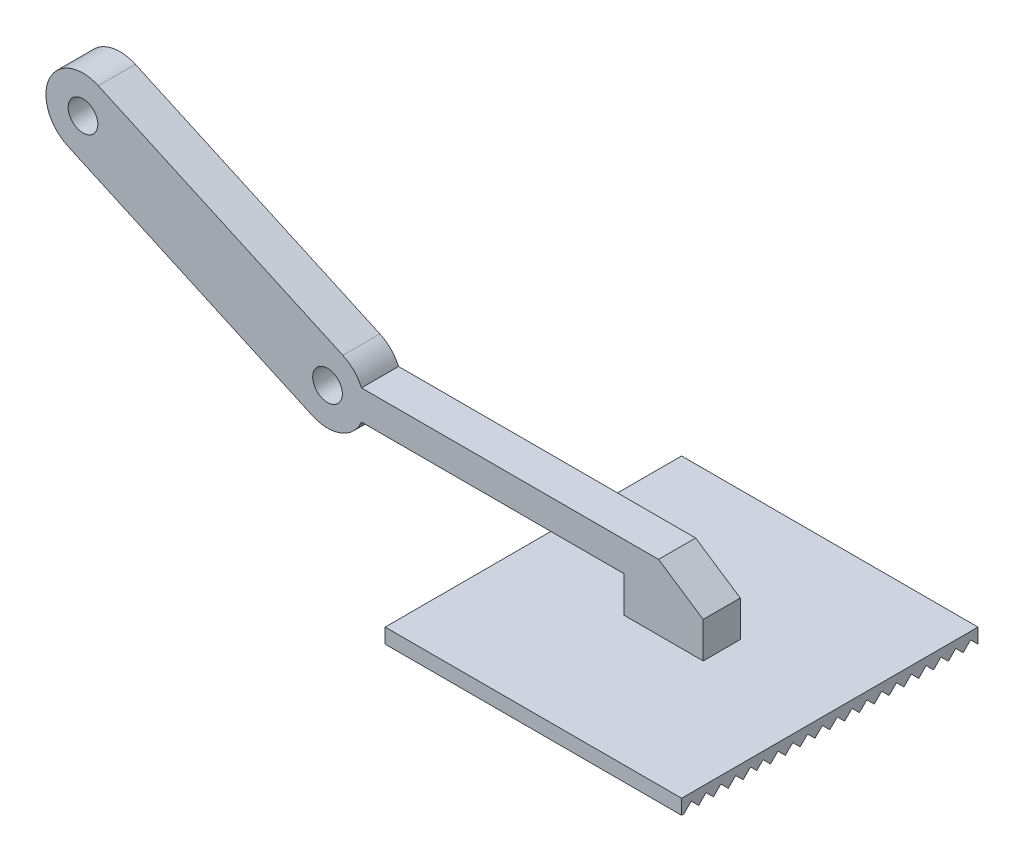
from build123d import *

# Parameters (mm, degrees)
SKETCH_1_R          = 2
EXTRUDE_1_DEPTH     = 2.5
SKETCH_2_W          = 40
SKETCH_2_H          = 40
EXTRUDE_2_DEPTH     = 2
CUT_EXTRUDE_1_DEPTH = 40


with BuildPart() as part:
    # 草图1 → 凸台-拉伸1 (new, symmetric)
    with BuildSketch(Plane.XY):
        with BuildLine():
            Line((2.069014722, 4.551832387), (35.069014722, -10.448167613))
            ThreePointArc((35.069014722, -10.448167613), (36.562144846, -11.491278851), (37.582575695, -13))
            Line((37.582575695, -13), (73, -13))
            Line((73, -13), (77.669363216, -13))
            Line((77.669363216, -13), (83.69352751, -17))
            Line((83.69352751, -17), (83.69352751, -21.856832822))
            Line((83.69352751, -21.856832822), (73, -21.856832822))
            Line((73, -21.856832822), (73, -17))
            Line((73, -17), (37.582575695, -17))
            ThreePointArc((37.582575695, -17), (34.790938113, -19.668248138), (30.930985278, -19.551832387))
            Line((30.930985278, -19.551832387), (-2.069014722, -4.551832387))
            ThreePointArc((-2.069014722, -4.551832387), (-4.551832387, 2.069014722), (2.069014722, 4.551832387))
        make_face()
        Circle(SKETCH_1_R, mode=Mode.SUBTRACT)
        with Locations((33, -15)):
            Circle(SKETCH_1_R, mode=Mode.SUBTRACT)
    extrude(amount=EXTRUDE_1_DEPTH, both=True)

    # 草图2 → 凸台-拉伸2 (add)
    with BuildSketch(Plane.XZ.offset(21.856832822)):
        with Locations((78.275712014, 0)):
            Rectangle(SKETCH_2_W, SKETCH_2_H)
    extrude(amount=EXTRUDE_2_DEPTH)

    # 草图4 → 切除-拉伸1 (cut)
    with BuildSketch(Plane.ZY.offset(-58.275712014)):
        Polygon((-19, -22.856832822), (-20, -23.856832822), (-18, -23.856832822), align=None)
        Polygon((-17, -22.856832822), (-18, -23.856832822), (-16, -23.856832822), align=None)
        Polygon((-15, -22.856832822), (-16, -23.856832822), (-14, -23.856832822), align=None)
        Polygon((-13, -22.856832822), (-14, -23.856832822), (-12, -23.856832822), align=None)
        Polygon((-11, -22.856832822), (-12, -23.856832822), (-10, -23.856832822), align=None)
        Polygon((-9, -22.856832822), (-10, -23.856832822), (-8, -23.856832822), align=None)
        Polygon((-7, -22.856832822), (-8, -23.856832822), (-6, -23.856832822), align=None)
        Polygon((-5, -22.856832822), (-6, -23.856832822), (-4, -23.856832822), align=None)
        Polygon((-3, -22.856832822), (-4, -23.856832822), (-2, -23.856832822), align=None)
        Polygon((-1, -22.856832822), (-2, -23.856832822), (0, -23.856832822), align=None)
        Polygon((1, -22.856832822), (0, -23.856832822), (2, -23.856832822), align=None)
        Polygon((3, -22.856832822), (2, -23.856832822), (4, -23.856832822), align=None)
        Polygon((5, -22.856832822), (4, -23.856832822), (6, -23.856832822), align=None)
        Polygon((7, -22.856832822), (6, -23.856832822), (8, -23.856832822), align=None)
        Polygon((9, -22.856832822), (8, -23.856832822), (11.695910697, -23.856832822), (10.695910697, -22.856832822), (9.847955349, -23.70478817), align=None)
        Polygon((12.695910697, -22.856832822), (11.695910697, -23.856832822), (13.695910697, -23.856832822), align=None)
        Polygon((18.695910697, -22.856832822), (17.695910697, -23.856832822), (19.695910697, -23.856832822), align=None)
        Polygon((16.695910697, -22.856832822), (15.695910697, -23.856832822), (17.695910697, -23.856832822), align=None)
        Polygon((14.695910697, -22.856832822), (13.695910697, -23.856832822), (15.695910697, -23.856832822), align=None)
    extrude(amount=-CUT_EXTRUDE_1_DEPTH, mode=Mode.SUBTRACT)


solid = part.part
